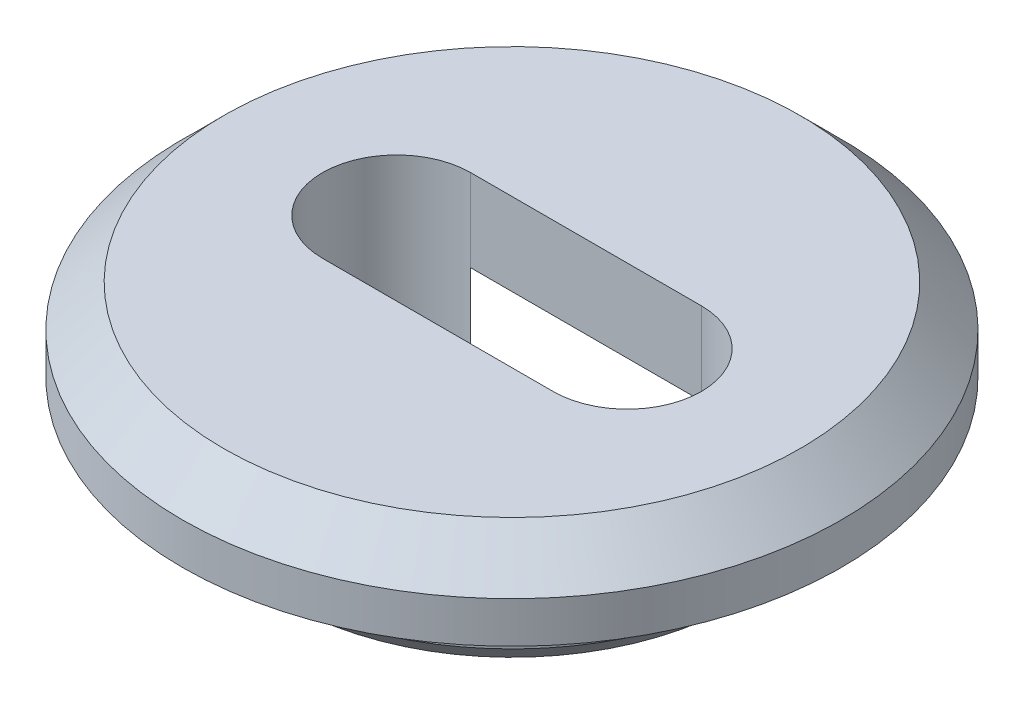
from build123d import *

# Parameters (mm, degrees)
CUT_EXTRUDE1_DEPTH = 13
SKETCH4_W          = 21.205208
SKETCH4_H          = 1.8
CUT_EXTRUDE2_DEPTH = 2
SKETCH5_W          = 20.395214747
SKETCH5_H          = 5.649183718
CUT_EXTRUDE3_DEPTH = 1.4
CHAMFER1_SIZE      = 1
CHAMFER2_SIZE      = 0.6


with BuildPart() as part:
    # Sketch1 → Revolve1 (revolve)
    with BuildSketch(Plane.XY, mode=Mode.PRIVATE) as revolve1_sk:
        Polygon((0, 0), (-8, 0), (-8, -2), (-6.1, -2), (-6.1, -4), (0, -4), align=None)
    revolve(revolve1_sk.sketch.rotate(Axis((0, 0, 0), (0, -1, 0)), 270), axis=Axis((0, 0, 0), (0, -1, 0)))

    # Sketch3 → Cut-Extrude1 (cut, through all)
    with BuildSketch(Plane(origin=(0, 0, 0), x_dir=(1, 0, 0), z_dir=(0, 1, 0))):
        with BuildLine():
            Line((-2.8, 1.8), (2.8, 1.8))
            ThreePointArc((2.8, 1.8), (4.6, 0), (2.8, -1.8))
            Line((2.8, -1.8), (-2.8, -1.8))
            ThreePointArc((-2.8, -1.8), (-4.6, 0), (-2.8, 1.8))
        make_face()
    extrude(amount=-CUT_EXTRUDE1_DEPTH, mode=Mode.SUBTRACT)

    # Sketch4 → Cut-Extrude2 (cut)
    with BuildSketch(Plane.XZ.offset(4)):
        with Locations((0.56076456, -2.7)):
            Rectangle(SKETCH4_W, SKETCH4_H)
    extrude(amount=-CUT_EXTRUDE2_DEPTH, mode=Mode.SUBTRACT)

    # Sketch5 → Cut-Extrude3 (cut)
    with BuildSketch(Plane.XZ.offset(4)):
        with Locations((-0.031153587, -4.97418934)):
            Rectangle(SKETCH5_W, SKETCH5_H)
    extrude(amount=-CUT_EXTRUDE3_DEPTH, mode=Mode.SUBTRACT)

    # Chamfer1
    chamfer1_edges = [part.edges().sort_by_distance(p)[0] for p in [
        (0, 0, -8),
    ]]
    chamfer(chamfer1_edges, length=CHAMFER1_SIZE)

    # Chamfer2
    chamfer2_edges = [part.edges().sort_by_distance(p)[0] for p in [
        (0, -4, 6.1),
    ]]
    chamfer(chamfer2_edges, length=CHAMFER2_SIZE)


solid = part.part
